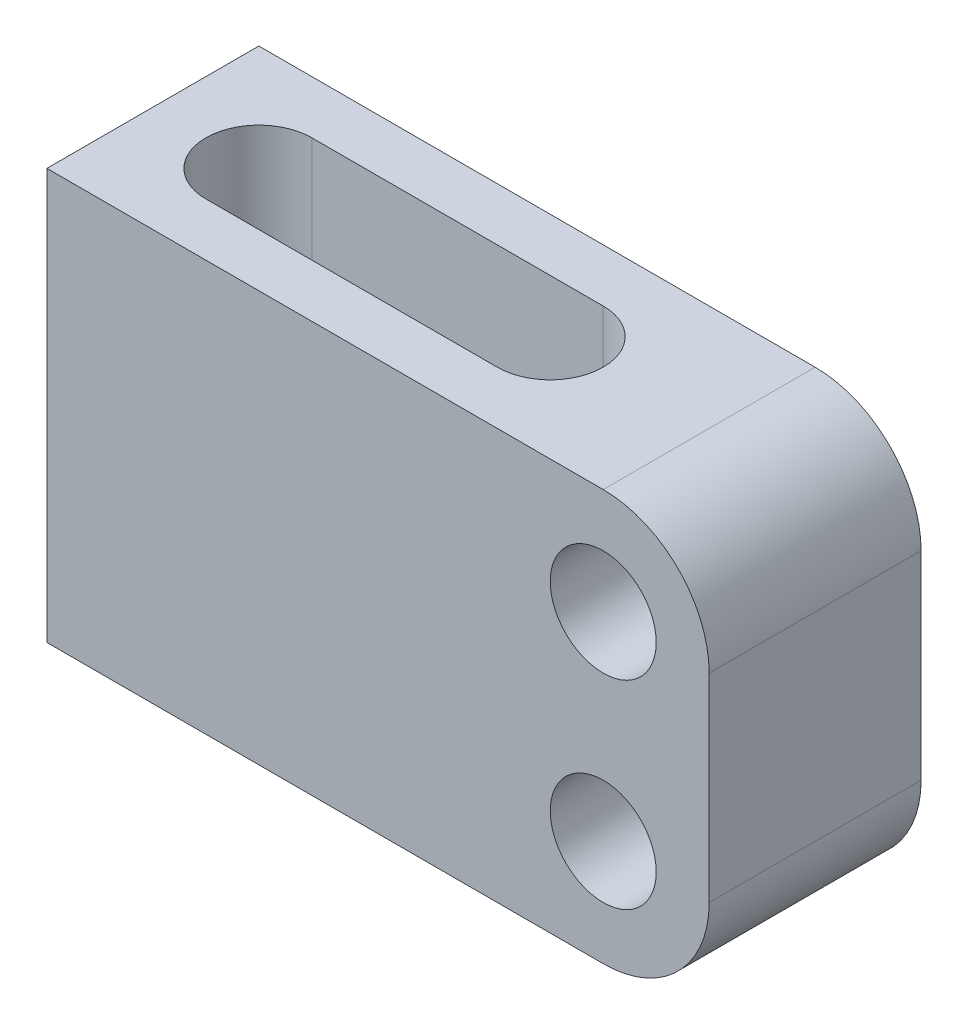
from build123d import *

# Parameters (mm, degrees)
SKETCH1_R           = 4
BOSS_EXTRUDE1_DEPTH = 16
CUT_EXTRUDE1_DEPTH  = 55.598534779


with BuildPart() as part:
    # Sketch1 → Boss-Extrude1 (new body)
    with BuildSketch(Plane.XY):
        with BuildLine():
            Line((8, 0), (8, -15))
            ThreePointArc((8, -15), (5.656854249, -20.656854249), (0, -23))
            Line((0, -23), (-42, -23))
            Line((-42, -23), (-42, 8))
            Line((-42, 8), (0, 8))
            ThreePointArc((0, 8), (5.656854249, 5.656854249), (8, 0))
        make_face()
        Circle(SKETCH1_R, mode=Mode.SUBTRACT)
        with Locations((0, -15)):
            Circle(SKETCH1_R, mode=Mode.SUBTRACT)
    extrude(amount=-BOSS_EXTRUDE1_DEPTH)

    # Sketch2 → Cut-Extrude1 (cut, through all)
    with BuildSketch(Plane(origin=(0, 8, 0), x_dir=(1, 0, 0), z_dir=(0, 1, 0))):
        with BuildLine():
            Line((-34, 12), (-12, 12))
            ThreePointArc((-12, 12), (-8, 8), (-12, 4))
            Line((-12, 4), (-34, 4))
            ThreePointArc((-34, 4), (-38, 8), (-34, 12))
        make_face()
    extrude(amount=-CUT_EXTRUDE1_DEPTH, mode=Mode.SUBTRACT)


solid = part.part
